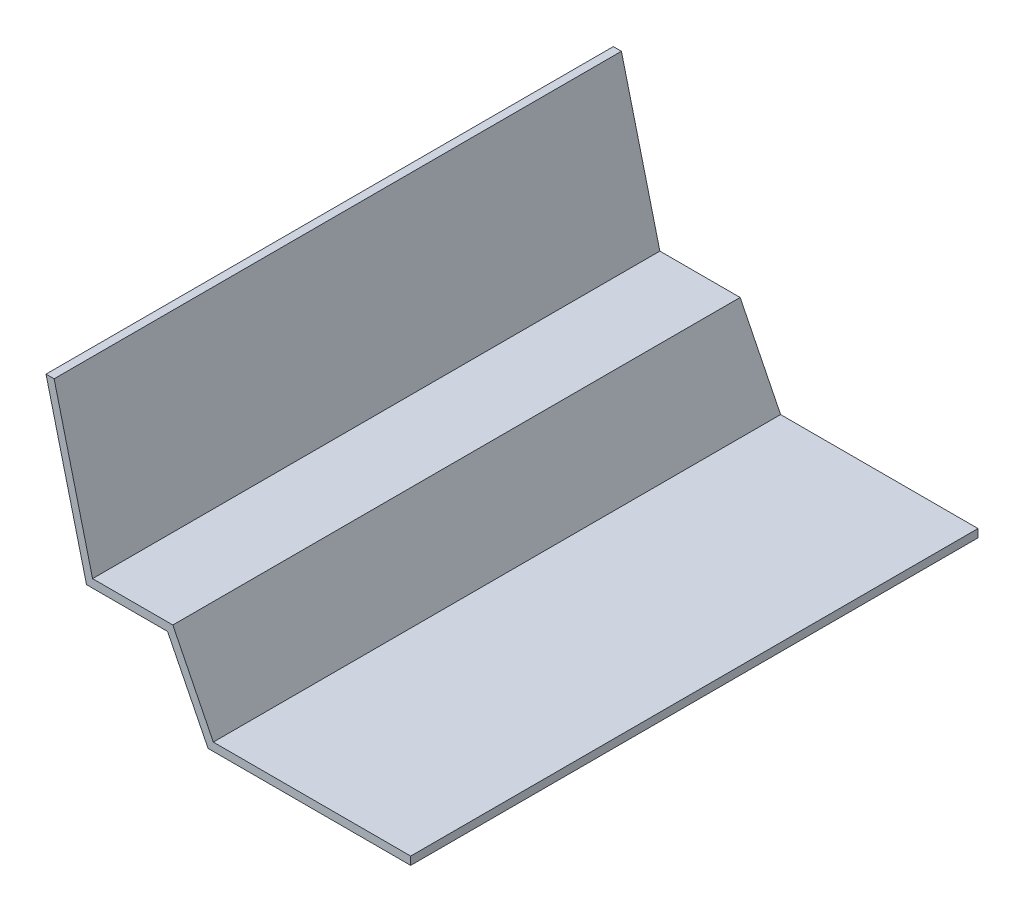
from build123d import *

# Parameters (mm, degrees)
EXTRUDE_1_DEPTH = 140


with BuildPart() as part:
    # 草图1 → 凸台-拉伸1 (new body)
    with BuildSketch(Plane.XY):
        Polygon((0, 0), (-50, 0), (-60, 20), (-80, 20), (-90, 60), (-88, 60), (-78.508386645, 22.033546579), (-58.701642421, 22.033546579), (-48.71360177, 2), (0, 2), align=None)
    extrude(amount=EXTRUDE_1_DEPTH)


solid = part.part
